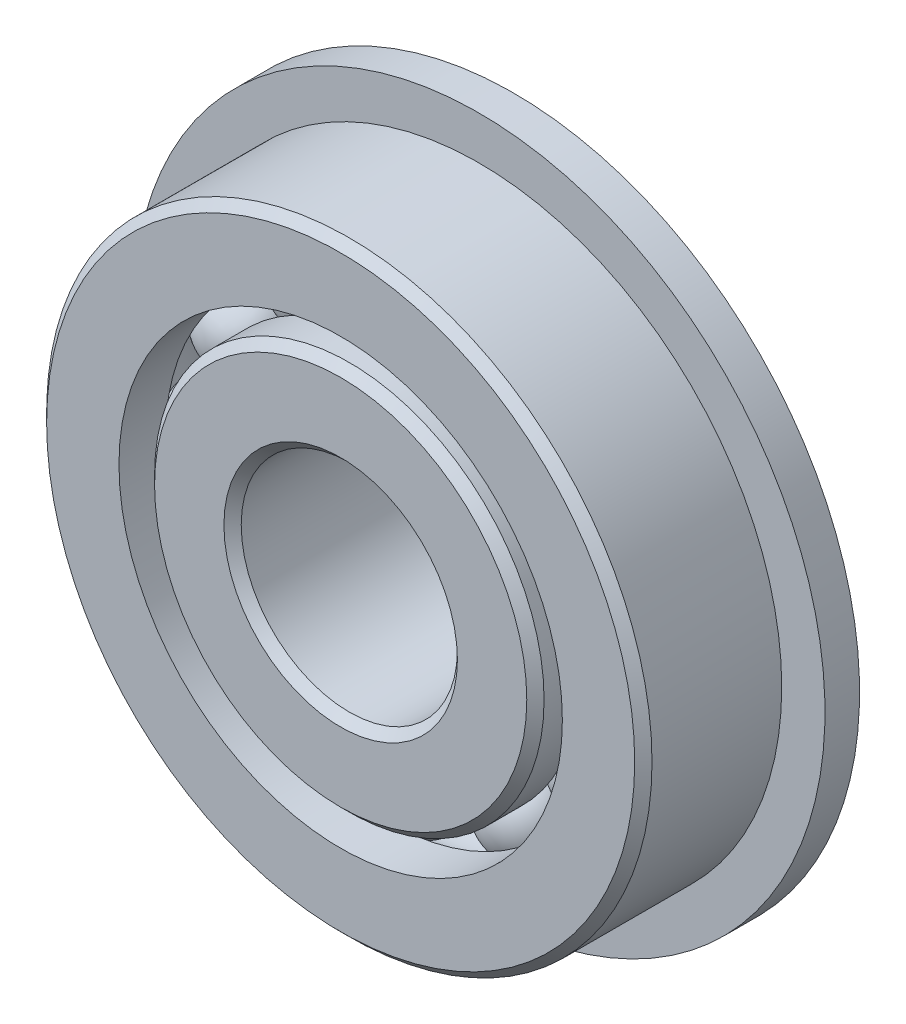
from build123d import *

# Parameters (mm, degrees)
SKETCH6_W         = 1.27
SKETCH6_H         = 4.5608875
CIRPATTERN1_COUNT = 12


with BuildPart() as part:
    # Sketch1 → Revolve1 (revolve)
    with BuildSketch(Plane(origin=(0, 0, 0), x_dir=(0, 0, -1), z_dir=(1, 0, 0))):
        with BuildLine():
            Line((2.8575, 11.1125), (-2.8575, 11.1125))
            Line((-2.8575, 11.1125), (-3.175, 10.795))
            Line((-3.175, 10.795), (-3.175, 8.1391125))
            Line((-3.175, 8.1391125), (-1.470363548, 8.1391125))
            ThreePointArc((-1.470363548, 8.1391125), (0, 9.128125), (1.470363548, 8.1391125))
            Line((1.470363548, 8.1391125), (3.175, 8.1391125))
            Line((3.175, 8.1391125), (3.175, 10.795))
            Line((3.175, 10.795), (2.8575, 11.1125))
        make_face()
    revolve(axis=Axis((0, 0, 3.175), (0, 0, -1)))

    # Sketch6 → Revolve6 (revolve)
    with BuildSketch(Plane(origin=(0, 0, 0), x_dir=(0, 0, -1), z_dir=(1, 0, 0))):
        with Locations((2.54, 10.41955625)):
            Rectangle(SKETCH6_W, SKETCH6_H)
    revolve(axis=Axis((0, 0, -3.175), (0, 0, 1)))


with BuildPart() as body_2:
    # Sketch3 → Revolve3 (revolve)
    with BuildSketch(Plane(origin=(0, 0, 0), x_dir=(0, 0, -1), z_dir=(1, 0, 0))):
        with BuildLine():
            Line((-3.175, 4.28625), (-3.175, 6.8326))
            Line((-3.175, 6.8326), (-2.8575, 7.1501))
            Line((-2.8575, 7.1501), (-1.538715852, 7.1501))
            ThreePointArc((-1.538715852, 7.1501), (0, 5.953125), (1.538715852, 7.1501))
            Line((1.538715852, 7.1501), (4.4577, 7.1501))
            Line((4.4577, 7.1501), (4.7752, 6.8326))
            Line((4.7752, 6.8326), (4.7752, 4.28625))
            Line((4.7752, 4.28625), (4.4577, 3.96875))
            Line((4.4577, 3.96875), (-2.8575, 3.96875))
            Line((-2.8575, 3.96875), (-3.175, 4.28625))
        make_face()
    revolve(axis=Axis((0, 0, 3.175), (0, 0, -1)))


with BuildPart() as body_3:
    # Sketch4 → Revolve4 (revolve)
    with BuildSketch(Plane(origin=(0, 0, 0), x_dir=(0, 0, -1), z_dir=(1, 0, 0))):
        with BuildLine():
            Line((-1.5875, 7.540625), (1.5875, 7.540625))
            ThreePointArc((1.5875, 7.540625), (0, 9.128125), (-1.5875, 7.540625))
        make_face()
    revolve(axis=Axis((0, 7.540625, 1.5875), (0, 0, -1)))


with BuildPart() as cirpattern1_1:
    # CirPattern1: pattern copy
    add(body_3.part.rotate(Axis((0, 0, -3.175), (0, 0, 1)), 1 * 360 / CIRPATTERN1_COUNT))


with BuildPart() as cirpattern1_2:
    # CirPattern1: pattern copy
    add(body_3.part.rotate(Axis((0, 0, -3.175), (0, 0, 1)), 2 * 360 / CIRPATTERN1_COUNT))


with BuildPart() as cirpattern1_3:
    # CirPattern1: pattern copy
    add(body_3.part.rotate(Axis((0, 0, -3.175), (0, 0, 1)), 3 * 360 / CIRPATTERN1_COUNT))


with BuildPart() as cirpattern1_4:
    # CirPattern1: pattern copy
    add(body_3.part.rotate(Axis((0, 0, -3.175), (0, 0, 1)), 4 * 360 / CIRPATTERN1_COUNT))


with BuildPart() as cirpattern1_5:
    # CirPattern1: pattern copy
    add(body_3.part.rotate(Axis((0, 0, -3.175), (0, 0, 1)), 5 * 360 / CIRPATTERN1_COUNT))


with BuildPart() as cirpattern1_6:
    # CirPattern1: pattern copy
    add(body_3.part.rotate(Axis((0, 0, -3.175), (0, 0, 1)), 6 * 360 / CIRPATTERN1_COUNT))


with BuildPart() as cirpattern1_7:
    # CirPattern1: pattern copy
    add(body_3.part.rotate(Axis((0, 0, -3.175), (0, 0, 1)), 7 * 360 / CIRPATTERN1_COUNT))


with BuildPart() as cirpattern1_8:
    # CirPattern1: pattern copy
    add(body_3.part.rotate(Axis((0, 0, -3.175), (0, 0, 1)), 8 * 360 / CIRPATTERN1_COUNT))


with BuildPart() as cirpattern1_9:
    # CirPattern1: pattern copy
    add(body_3.part.rotate(Axis((0, 0, -3.175), (0, 0, 1)), 9 * 360 / CIRPATTERN1_COUNT))


with BuildPart() as cirpattern1_10:
    # CirPattern1: pattern copy
    add(body_3.part.rotate(Axis((0, 0, -3.175), (0, 0, 1)), 10 * 360 / CIRPATTERN1_COUNT))


with BuildPart() as cirpattern1_11:
    # CirPattern1: pattern copy
    add(body_3.part.rotate(Axis((0, 0, -3.175), (0, 0, 1)), 11 * 360 / CIRPATTERN1_COUNT))


solid = Compound([part.part, body_2.part, body_3.part, cirpattern1_1.part, cirpattern1_2.part, cirpattern1_3.part, cirpattern1_4.part, cirpattern1_5.part, cirpattern1_6.part, cirpattern1_7.part, cirpattern1_8.part, cirpattern1_9.part, cirpattern1_10.part, cirpattern1_11.part])
